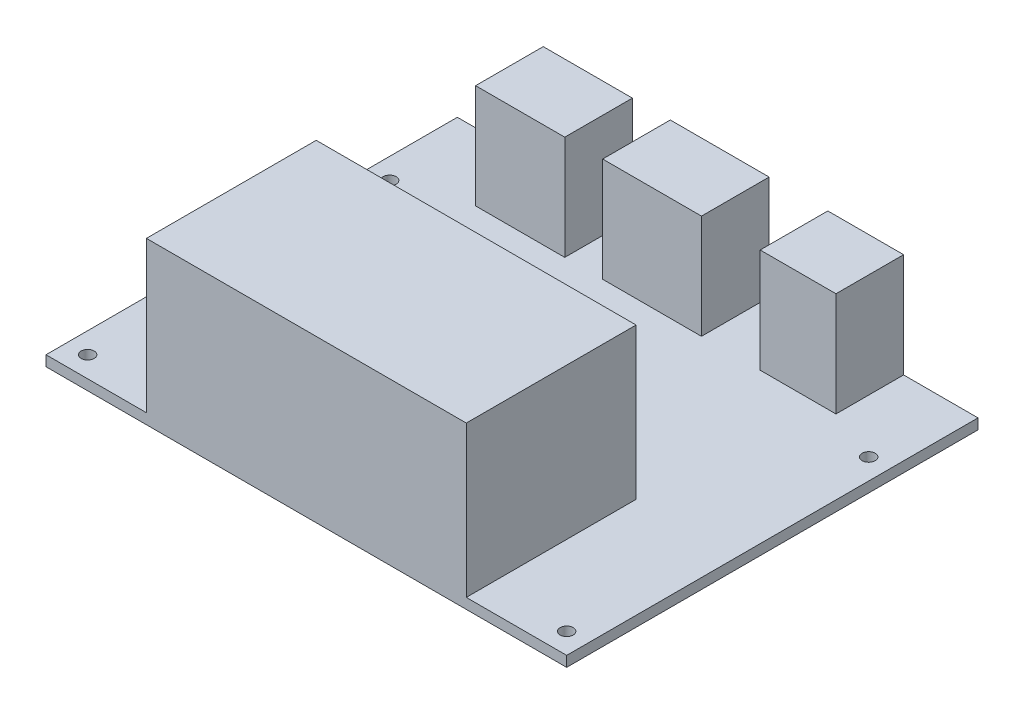
from build123d import *

# Parameters (mm, degrees)
SKETCH_1_W      = 100
SKETCH_1_H      = 79
SKETCH_1_R      = 1.25
EXTRUDE_1_DEPTH = 2
SKETCH_2_W      = 22.62402863
SKETCH_2_H      = 13.977148577
EXTRUDE_2_DEPTH = 3
SKETCH_3_W      = 61.437231596
SKETCH_3_H      = 32.614177876
EXTRUDE_3_DEPTH = 29
SKETCH_4_W      = 17.125360724
SKETCH_4_H      = 12.991368713
SKETCH_4_W_2    = 18.980608136
SKETCH_4_W_3    = 14.556556615
EXTRUDE_4_DEPTH = 20


with BuildPart() as part:
    # 草图1 → 凸台-拉伸1 (new body)
    with BuildSketch(Plane(origin=(0, 0, 0), x_dir=(1, 0, 0), z_dir=(0, 1, 0))):
        Rectangle(SKETCH_1_W, SKETCH_1_H)
        with Locations(Location((-46, 22.5, 0), (0, 0, 270))):
            Circle(SKETCH_1_R, mode=Mode.SUBTRACT)
        with Locations(Location((46, 22.5, 0), (0, 0, 270))):
            Circle(SKETCH_1_R, mode=Mode.SUBTRACT)
        with Locations(Location((46, -35.5, 0), (0, 0, 270))):
            Circle(SKETCH_1_R, mode=Mode.SUBTRACT)
        with Locations(Location((-46, -35.5, 0), (0, 0, 270))):
            Circle(SKETCH_1_R, mode=Mode.SUBTRACT)
    extrude(amount=EXTRUDE_1_DEPTH)

    # 草图2 → 凸台-拉伸2 (add)
    with BuildSketch(Plane.XZ):
        with Locations((-15.800196743, 15.117537052)):
            Rectangle(SKETCH_2_W, SKETCH_2_H)
    extrude(amount=EXTRUDE_2_DEPTH)

    # 草图3 → 凸台-拉伸3 (add)
    with BuildSketch(Plane(origin=(0, 2, 0), x_dir=(1, 0, 0), z_dir=(0, 1, 0))):
        with Locations((0, -23.192911062)):
            Rectangle(SKETCH_3_W, SKETCH_3_H)
    extrude(amount=EXTRUDE_3_DEPTH)

    # 草图4 → 凸台-拉伸4 (add)
    with BuildSketch(Plane(origin=(0, 2, 0), x_dir=(1, 0, 0), z_dir=(0, 1, 0))):
        with Locations((-24.938806554, 33.004315644)):
            Rectangle(SKETCH_4_W, SKETCH_4_H)
        with Locations((0.392456183, 33.004315644)):
            Rectangle(SKETCH_4_W_2, SKETCH_4_H)
        with Locations((28.435234369, 33.004315644)):
            Rectangle(SKETCH_4_W_3, SKETCH_4_H)
    extrude(amount=EXTRUDE_4_DEPTH)


solid = part.part
